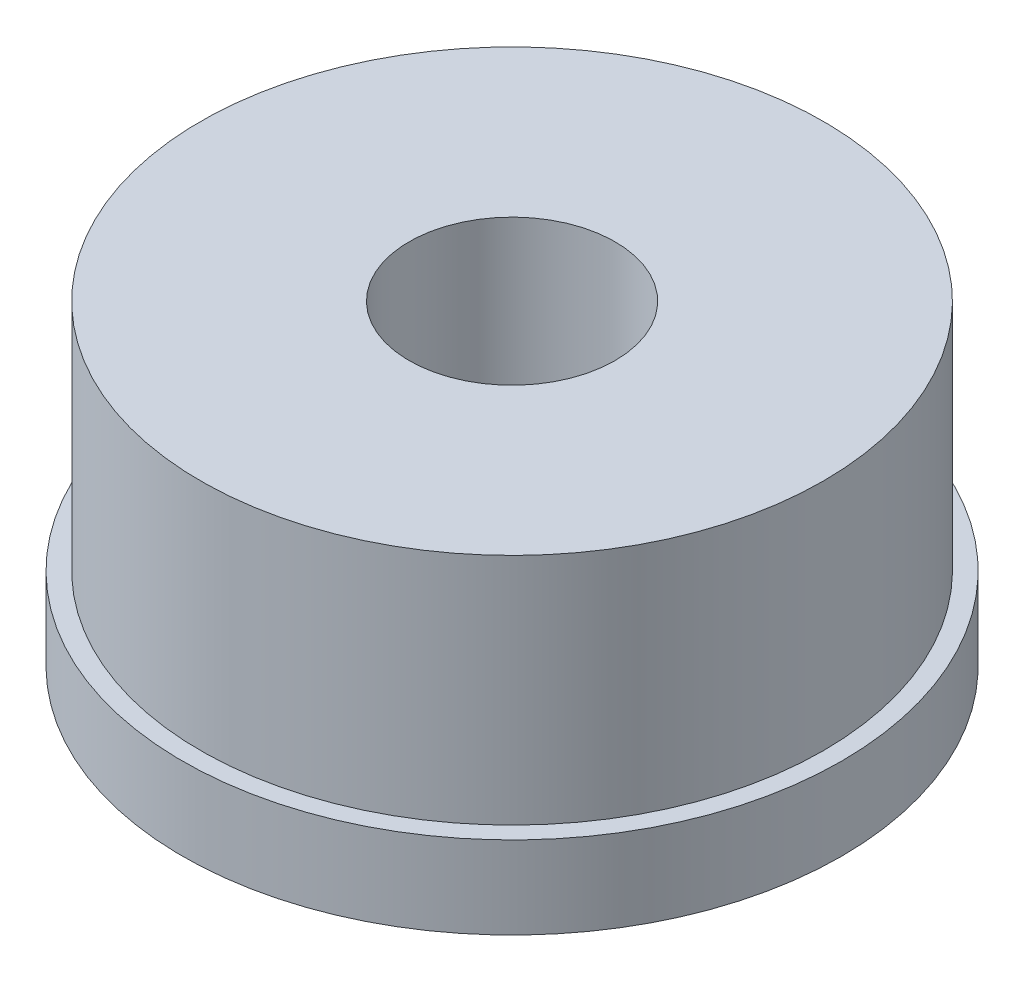
from build123d import *

# Parameters (mm, degrees)
BOSS_EXTRUDE1_START = 1
SKETCH1_R           = 12
SKETCH1_R_2         = 3.96875
BOSS_EXTRUDE1_DEPTH = 9
SKETCH2_R           = 12.7
SKETCH2_R_2         = 3.96875
BOSS_EXTRUDE2_DEPTH = 3.175


with BuildPart() as part:
    # Sketch1 → Boss-Extrude1 (new body)
    with BuildSketch(Plane.XZ.offset(-416.886404018).offset(BOSS_EXTRUDE1_START)):
        with Locations((1275.15372842, 121.258293716)):
            Circle(SKETCH1_R)
        with Locations((1275.15372842, 121.258293716)):
            Circle(SKETCH1_R_2, mode=Mode.SUBTRACT)
    extrude(amount=BOSS_EXTRUDE1_DEPTH)

    # Sketch2 → Boss-Extrude2 (add)
    with BuildSketch(Plane.XZ.offset(-406.886404018)):
        with Locations((1275.15372842, 121.258293716)):
            Circle(SKETCH2_R)
        with Locations((1275.15372842, 121.258293716)):
            Circle(SKETCH2_R_2, mode=Mode.SUBTRACT)
    extrude(amount=BOSS_EXTRUDE2_DEPTH)


solid = part.part
